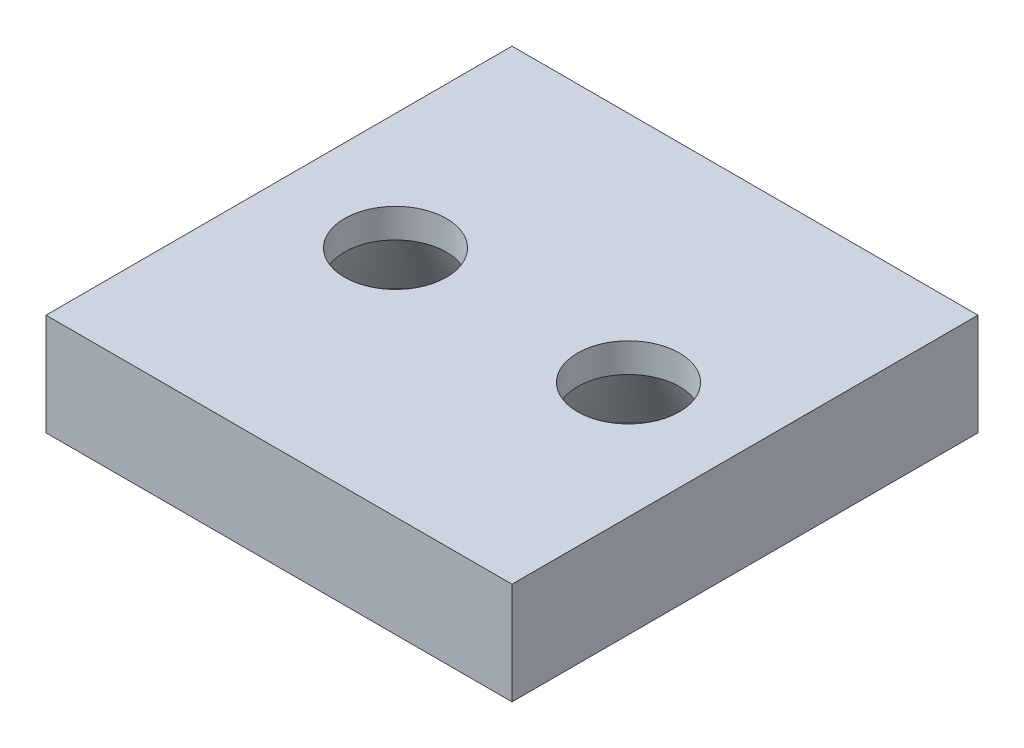
from build123d import *

# Parameters (mm, degrees)
SKETCH1_W           = 32
SKETCH1_H           = 32
BOSS_EXTRUDE1_DEPTH = 7
LPATTERN1_COUNT     = 2
LPATTERN1_PITCH     = 16


with BuildPart() as part:
    # Sketch1 → Boss-Extrude1 (new body)
    with BuildSketch(Plane(origin=(0, 0, 0), x_dir=(1, 0, 0), z_dir=(0, 1, 0))):
        Rectangle(SKETCH1_W, SKETCH1_H)
    extrude(amount=BOSS_EXTRUDE1_DEPTH)

    # Sketch3 → CSK for M2 Flat Head Machine Screw1 (revolve, cut)
    with BuildSketch(Plane(origin=(-8, 0, 0), x_dir=(0, 0, -1), z_dir=(1, 0, 0))):
        Polygon((0, 0), (0, 18.020725942), (3.5, 16), (3.5, 4.999754046), (6.5, 0), align=None)
    csk_for_m2_flat_head_machine_screw1 = revolve(axis=Axis((-8, -6.35, 0), (0, 1, 0)), mode=Mode.SUBTRACT)

    # LPattern1: CSK for M2 Flat Head Machine Screw1 ×2
    with Locations(*[(i * LPATTERN1_PITCH, 0, 0) for i in range(1, LPATTERN1_COUNT)]):
        add(csk_for_m2_flat_head_machine_screw1, mode=Mode.SUBTRACT)


solid = part.part
